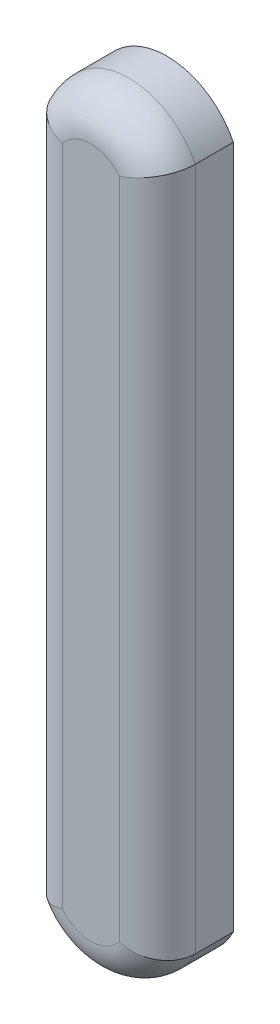
from build123d import *

# Parameters (mm, degrees)
BOSS_EXTRU_1_DEPTH = 0.2
CONG_1_R           = 0.1


with BuildPart() as part:
    # Esquisse1 → Boss.-Extru.1 (new body)
    with BuildSketch(Plane.XY):
        with BuildLine():
            Line((0, 0), (0, 1.8))
            ThreePointArc((0, 1.8), (0.175, 1.909006611), (0.35, 1.8))
            Line((0.35, 1.8), (0.35, 0))
            ThreePointArc((0.35, 0), (0.175, -0.109006611), (0, 0))
        make_face()
    extrude(amount=BOSS_EXTRU_1_DEPTH)

    # Congé1
    cong_1_edges = [part.edges().sort_by_distance(p)[0] for p in [
        (0.175, 1.909006611, 0.2),
        (0, 0.9, 0.2),
        (0.175, -0.109006611, 0.2),
        (0.35, 0.9, 0.2),
    ]]
    fillet(cong_1_edges, radius=CONG_1_R)


solid = part.part
